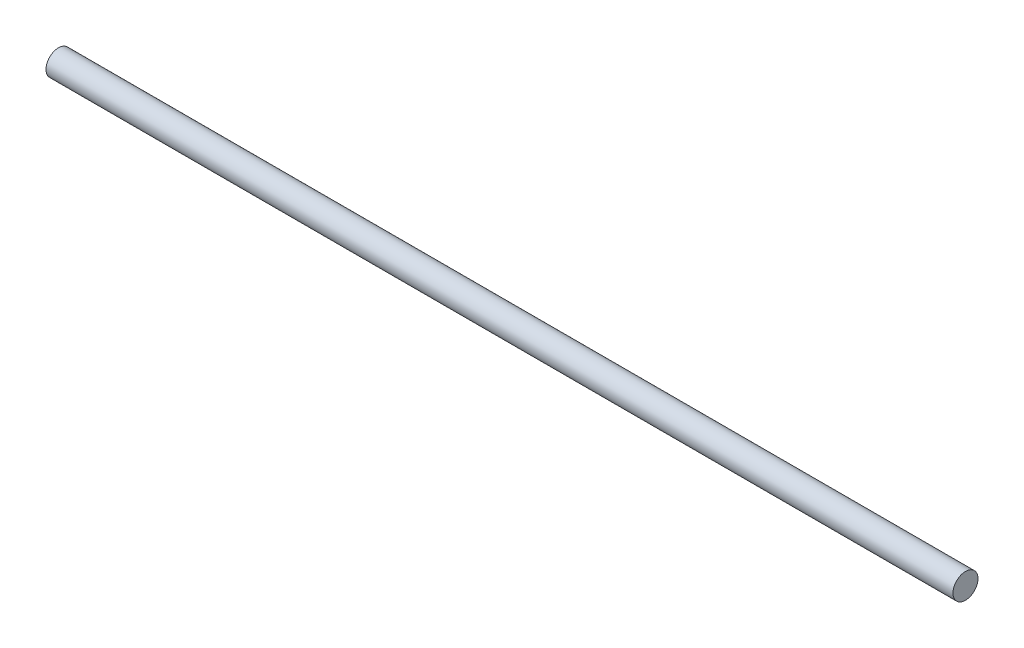
from build123d import *

# Parameters (mm, degrees)
SKETCH_1_R      = 4
EXTRUDE_1_DEPTH = 290


with BuildPart() as part:
    # 草图1 → 凸台-拉伸1 (new body)
    with BuildSketch(Plane(origin=(0, 0, 0), x_dir=(0, 0, -1), z_dir=(1, 0, 0))):
        Circle(SKETCH_1_R)
    extrude(amount=EXTRUDE_1_DEPTH)


solid = part.part
